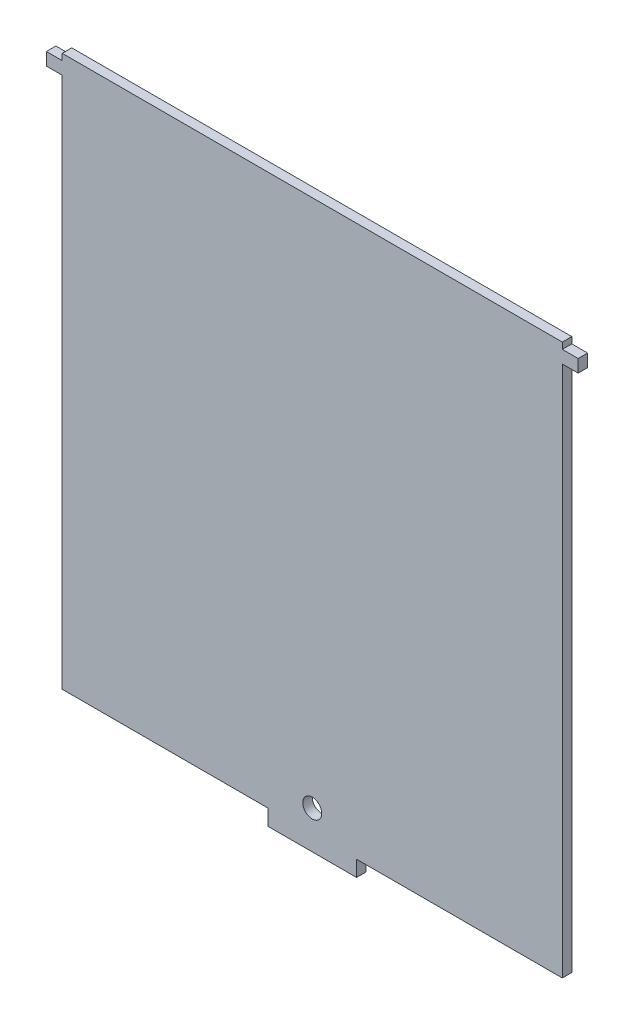
from build123d import *

# Parameters (mm, degrees)
SKETCH2_R           = 3
BOSS_EXTRUDE1_DEPTH = 3


with BuildPart() as part:
    # Sketch2 → Boss-Extrude1 (new body)
    with BuildSketch(Plane.XY):
        Polygon((10.435104765, -72.320574163), (75.435104765, -72.320574163), (75.435104765, 95.679425837), (80.435104765, 95.679425837), (80.435104765, 99.679425837), (75.435104765, 99.679425837), (75.435104765, 101.679425837), (-82.564895235, 101.679425837), (-82.564895235, 99.679425837), (-87.564895235, 99.679425837), (-87.564895235, 95.679425837), (-82.564895235, 95.679425837), (-82.564895235, -72.320574163), (-17.564895235, -72.320574163), (-17.564895235, -77.320574163), (10.435104765, -77.320574163), align=None)
        with Locations((-3.564895235, -65.320574163)):
            Circle(SKETCH2_R, mode=Mode.SUBTRACT)
    extrude(amount=BOSS_EXTRUDE1_DEPTH)


solid = part.part
